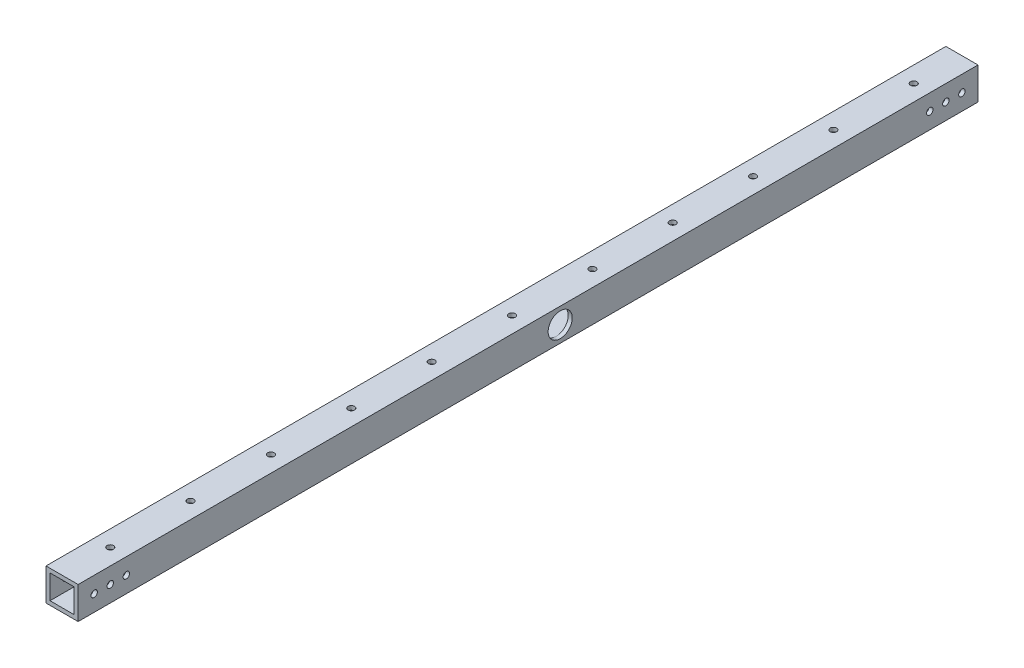
from build123d import *

# Parameters (mm, degrees)
SKETCH1_W               = 25.4
SKETCH1_H               = 25.4
SKETCH1_W_2             = 19.05
SKETCH1_H_2             = 19.05
EXTRUDE_THIN1_DEPTH     = 711.2
F_10_CLEARANCE_HOLE1_D  = 5.1054
LPATTERN1_COUNT         = 11
LPATTERN1_PITCH         = 63.5
F_10_CLEARANCE_HOLE2_D  = 5.1054
F_10_CLEARANCE_HOLE3_D  = 5.1054
CUT_EXTRUDE1_DEPTH      = 713.106565059
CUT_EXTRUDE1_DEPTH_BACK = 713.106565059
SKETCH8_R               = 9.525


with BuildPart() as part:
    # Sketch1 → Extrude-Thin1 (new body)
    with BuildSketch(Plane.XY):
        with Locations((-12.7, 12.7)):
            Rectangle(SKETCH1_W, SKETCH1_H)
        with Locations((-12.7, 12.7)):
            Rectangle(SKETCH1_W_2, SKETCH1_H_2, mode=Mode.SUBTRACT)
    extrude(amount=EXTRUDE_THIN1_DEPTH)

    # #10 Clearance Hole1 (through all)
    with Locations(Plane(origin=(0, 25.4, 0), x_dir=(1, 0, 0), z_dir=(0, 1, 0))):
        with Locations((-12.7, -673.1)):
            f_10_clearance_hole1 = Hole(F_10_CLEARANCE_HOLE1_D / 2)

    # LPattern1: #10 Clearance Hole1 ×11
    with Locations(*[(0, 0, -i * LPATTERN1_PITCH) for i in range(1, LPATTERN1_COUNT)]):
        add(f_10_clearance_hole1, mode=Mode.SUBTRACT)

    # #10 Clearance Hole2 (through all)
    with Locations(Plane(origin=(0, 0, 0), x_dir=(0, 0, -1), z_dir=(1, 0, 0))):
        with Locations((-698.5, 12.7), (-685.8, 12.7), (-673.1, 12.7)):
            Hole(F_10_CLEARANCE_HOLE2_D / 2)

    # #10 Clearance Hole3 (through all)
    with Locations(Plane(origin=(0, 0, 0), x_dir=(0, 0, -1), z_dir=(1, 0, 0))):
        with Locations((-38.1, 12.7), (-25.4, 12.7), (-12.7, 12.7)):
            Hole(F_10_CLEARANCE_HOLE3_D / 2)

    # Sketch8 → Cut-Extrude1 (cut, two sides: drawn at the far end of the back side and taken through both)
    with BuildSketch(Plane.ZY.offset(25.4).offset(-CUT_EXTRUDE1_DEPTH_BACK)):
        with Locations(Location((330.2, 12.7, 0), (0, 0, 270))):
            Circle(SKETCH8_R)
    extrude(amount=CUT_EXTRUDE1_DEPTH + CUT_EXTRUDE1_DEPTH_BACK, mode=Mode.SUBTRACT)


solid = part.part
